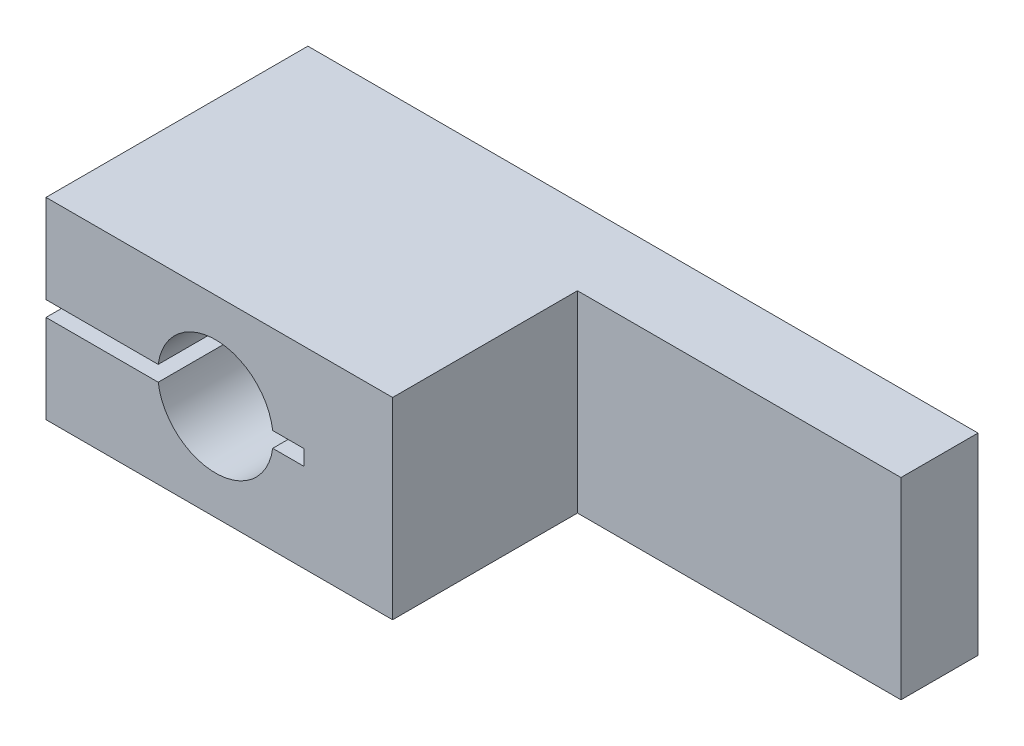
from build123d import *

# Parameters (mm, degrees)
LINEAR_AUSTRAGEN1_DEPTH         = 34
SCHNITT_LINEAR_AUSTRAGEN1_REACH = 79.498
SKIZZE8_W                       = 42
SKIZZE8_H                       = 24


with BuildPart() as part:
    # Skizze1 → Linear austragen1 (new body)
    with BuildSketch(Plane.XY):
        with BuildLine():
            Line((-22, -1), (-22, -12.5))
            Line((-22, -12.5), (65, -12.5))
            Line((65, -12.5), (65, 12.5))
            Line((65, 12.5), (-22, 12.5))
            Line((-22, 12.5), (-22, 1))
            Line((-22, 1), (-7.433034374, 1))
            ThreePointArc((-7.433034374, 1), (0, 7.5), (7.433034374, 1))
            Line((7.433034374, 1), (11.5, 1))
            Line((11.5, 1), (11.5, -1))
            Line((11.5, -1), (7.433034374, -1))
            ThreePointArc((7.433034374, -1), (0, -7.5), (-7.433034374, -1))
            Line((-7.433034374, -1), (-22, -1))
        make_face()
    extrude(amount=-LINEAR_AUSTRAGEN1_DEPTH)

    # Skizze8 → Schnitt-Linear austragen1 (cut, up to next)
    with BuildSketch(Plane.XZ.offset(12.5), mode=Mode.PRIVATE) as schnitt_linear_austragen1_sk1:
        with Locations((44, -12)):
            Rectangle(SKIZZE8_W, SKIZZE8_H)
    schnitt_linear_austragen1_tool1 = extrude(schnitt_linear_austragen1_sk1.sketch, amount=-SCHNITT_LINEAR_AUSTRAGEN1_REACH, mode=Mode.PRIVATE) & part.part
    add(schnitt_linear_austragen1_tool1.solids().sort_by_distance((44, -12.5, -12))[0], mode=Mode.SUBTRACT)


solid = part.part
